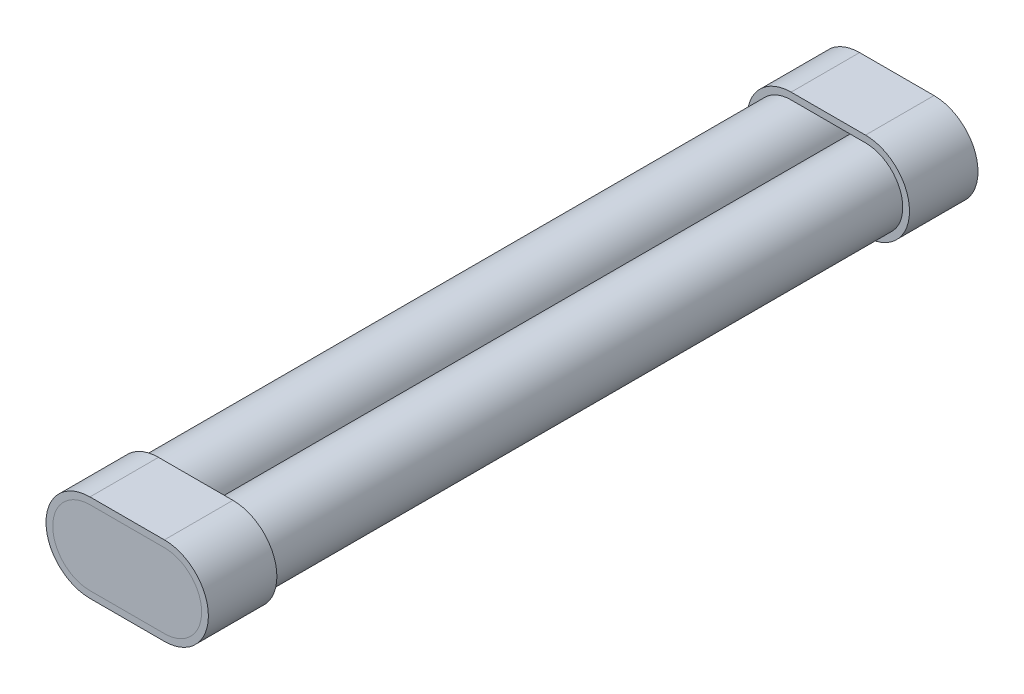
from build123d import *

# Parameters (mm, degrees)
ESQUISSE1_R              = 11
BOSS_EXTRU_2_DEPTH       = 223.5
BOSS_EXTRU_2_2_DEPTH     = 223.5
BOSS_EXTRU_8_DEPTH       = 2
BOSS_EXTRU_8_DEPTH_BACK  = 18.25
BOSS_EXTRU_29_DEPTH      = 2
BOSS_EXTRU_33_DEPTH      = 2
BOSS_EXTRU_33_DEPTH_BACK = 18.25
BOSS_EXTRU_34_DEPTH      = 2


with BuildPart() as part:
    # Esquisse1 → Boss.-Extru.2 (new body)
    with BuildSketch(Plane.XY):
        with Locations((-11, 0)):
            Circle(ESQUISSE1_R)
    extrude(amount=-BOSS_EXTRU_2_DEPTH)


with BuildPart() as body_2:
    # Esquisse1 → Boss.-Extru.2 2 (new body)
    with BuildSketch(Plane.XY):
        with Locations((11, 0)):
            Circle(ESQUISSE1_R)
    extrude(amount=-BOSS_EXTRU_2_2_DEPTH)


with BuildPart() as body_3:
    # Esquisse1<5> → Boss.-Extru.8 (new, two sides: drawn at the far end of the back side and taken through both)
    with BuildSketch(Plane.XY.offset(-BOSS_EXTRU_8_DEPTH_BACK)):
        with BuildLine():
            Line((11, 13), (-11, 13))
            ThreePointArc((-11, 13), (-24, 0), (-11, -13))
            Line((-11, -13), (11, -13))
            ThreePointArc((11, -13), (24, 0), (11, 13))
        make_face()
        with BuildLine():
            Line((11, -11), (-11, -11))
            ThreePointArc((-11, -11), (-22, 0), (-11, 11))
            Line((-11, 11), (11, 11))
            ThreePointArc((11, 11), (18.778174593, 7.778174593), (22, 0))
            ThreePointArc((22, 0), (18.778174593, -7.778174593), (11, -11))
        make_face(mode=Mode.SUBTRACT)
    extrude(amount=BOSS_EXTRU_8_DEPTH + BOSS_EXTRU_8_DEPTH_BACK)


with BuildPart() as body_4:
    # Esquisse1<6> → Boss.-Extru.29 (new body)
    with BuildSketch(Plane.XY):
        with BuildLine():
            Line((-11, -11), (11, -11))
            ThreePointArc((11, -11), (22, 0), (11, 11))
            Line((11, 11), (-11, 11))
            ThreePointArc((-11, 11), (-22, 0), (-11, -11))
        make_face()
    extrude(amount=BOSS_EXTRU_29_DEPTH)


with BuildPart() as body_5:
    # Esquisse8 → Boss.-Extru.33 (new, two sides: drawn at the far end of the back side and taken through both)
    with BuildSketch(Plane(origin=(0, 0, -223.5), x_dir=(-1, 0, 0), z_dir=(0, 0, -1)).offset(-BOSS_EXTRU_33_DEPTH_BACK)):
        with BuildLine():
            Line((11, 13), (-11, 13))
            ThreePointArc((-11, 13), (-24, 0), (-11, -13))
            Line((-11, -13), (11, -13))
            ThreePointArc((11, -13), (24, 0), (11, 13))
        make_face()
        with BuildLine():
            Line((11, -11), (-11, -11))
            ThreePointArc((-11, -11), (-22, 0), (-11, 11))
            Line((-11, 11), (11, 11))
            ThreePointArc((11, 11), (18.778174593, 7.778174593), (22, 0))
            ThreePointArc((22, 0), (18.778174593, -7.778174593), (11, -11))
        make_face(mode=Mode.SUBTRACT)
    extrude(amount=BOSS_EXTRU_33_DEPTH + BOSS_EXTRU_33_DEPTH_BACK)


with BuildPart() as body_6:
    # Esquisse8<3> → Boss.-Extru.34 (new body)
    with BuildSketch(Plane(origin=(0, 0, -223.5), x_dir=(-1, 0, 0), z_dir=(0, 0, -1))):
        with BuildLine():
            Line((-11, -11), (11, -11))
            ThreePointArc((11, -11), (22, 0), (11, 11))
            Line((11, 11), (-11, 11))
            ThreePointArc((-11, 11), (-22, 0), (-11, -11))
        make_face()
    extrude(amount=BOSS_EXTRU_34_DEPTH)


solid = Compound([part.part, body_2.part, body_3.part, body_4.part, body_5.part, body_6.part])
